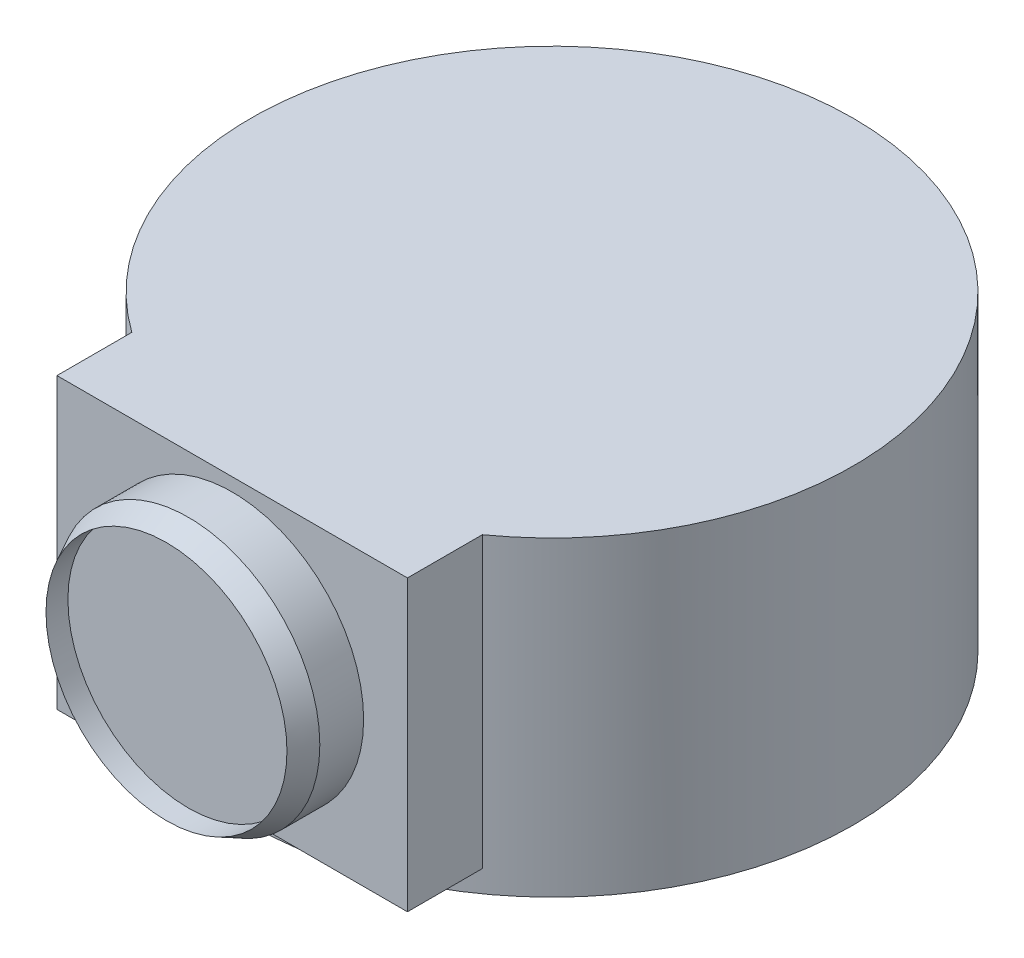
from build123d import *

# Parameters (mm, degrees)
SKETCH1_R           = 68.75
BOSS_EXTRUDE1_DEPTH = 66
BOSS_EXTRUDE3_DEPTH = 83
SKETCH5_R           = 56.242985336
SKETCH5_R_2         = 30
CUT_EXTRUDE2_DEPTH  = 10
BOSS_EXTRUDE4_START = 5
SKETCH6_R           = 68.75
BOSS_EXTRUDE4_DEPTH = 5


with BuildPart() as part:
    # Sketch1 → Boss-Extrude1 (new body)
    with BuildSketch(Plane(origin=(0, 0, 0), x_dir=(1, 0, 0), z_dir=(0, 1, 0))):
        with Locations(Location((0, 0, 0), (0, 0, 270))):
            Circle(SKETCH1_R)
    extrude(amount=BOSS_EXTRUDE1_DEPTH)

    # Sketch2 → Boss-Extrude3 (add)
    with BuildSketch(Plane.XY):
        Polygon((-40, 66), (-40, 0), (0, 0), (40, 0), (40, 66), align=None)
    extrude(amount=BOSS_EXTRUDE3_DEPTH)

    # Sketch4 → Revolve1 (revolve)
    with BuildSketch(Plane(origin=(0, 0, 0), x_dir=(0, 0, -1), z_dir=(1, 0, 0)), mode=Mode.PRIVATE) as revolve1_sk:
        Polygon((-83, 5.5), (-88, 5.5), (-83, 3), align=None)
    revolve(revolve1_sk.sketch.rotate(Axis((0, 33, 83), (0, 0, -1)), 270), axis=Axis((0, 33, 83), (0, 0, -1)))

    # Sketch5 → Cut-Extrude2 (cut)
    with BuildSketch(Plane.XY.offset(83)):
        with Locations((0, 33)):
            Circle(SKETCH5_R)
        with Locations((0, 33)):
            Circle(SKETCH5_R_2, mode=Mode.SUBTRACT)
    extrude(amount=-CUT_EXTRUDE2_DEPTH, mode=Mode.SUBTRACT)

    # Sketch6 → Boss-Extrude4 (add)
    with BuildSketch(Plane(origin=(0, 0, 0), x_dir=(-1, 0, 0), z_dir=(0, -1, 0)).offset(BOSS_EXTRUDE4_START)):
        with Locations(Location((0, 0, 0), (0, 0, 90))):
            Circle(SKETCH6_R)
    extrude(amount=-BOSS_EXTRUDE4_DEPTH)


solid = part.part
